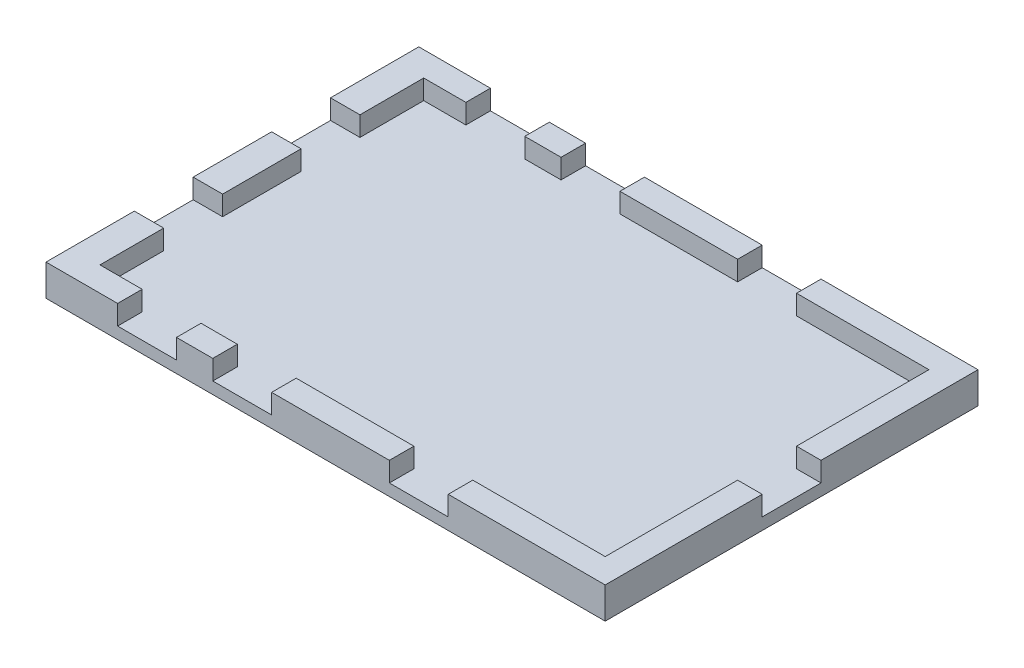
from build123d import *

# Parameters (mm, degrees)
SKETCH1_W           = 57
SKETCH1_H           = 38
BOSS_EXTRUDE1_DEPTH = 1.2
SKETCH3_W           = 3.7
SKETCH3_H           = 2.5
SKETCH3_W_2         = 3
SKETCH3_H_2         = 8
SKETCH3_W_3         = 12
BOSS_EXTRUDE2_DEPTH = 2


with BuildPart() as part:
    # Sketch1 → Boss-Extrude1 (new body)
    with BuildSketch(Plane(origin=(0, 0, 0), x_dir=(1, 0, 0), z_dir=(0, 1, 0))):
        with Locations((-1.5, 0)):
            Rectangle(SKETCH1_W, SKETCH1_H)
    extrude(amount=BOSS_EXTRUDE1_DEPTH)

    # Sketch3 → Boss-Extrude2 (add)
    with BuildSketch(Plane(origin=(0, 1.2, 0), x_dir=(1, 0, 0), z_dir=(0, 1, 0))):
        Polygon((-22.7, -16.5), (-27, -16.5), (-27, -10), (-30, -10), (-30, -19), (-22.7, -19), align=None)
        with Locations((-14.85, -17.75)):
            Rectangle(SKETCH3_W, SKETCH3_H)
        with Locations((-28.5, 0)):
            Rectangle(SKETCH3_W_2, SKETCH3_H_2)
        with Locations((-1, -17.75)):
            Rectangle(SKETCH3_W_3, SKETCH3_H)
        Polygon((11, -16.5), (11, -19), (27, -19), (27, -3), (24.5, -3), (24.5, -16.5), align=None)
        Polygon((24.5, 16.5), (24.5, 3), (27, 3), (27, 19), (11, 19), (11, 16.5), align=None)
        Polygon((-30, 10), (-27, 10), (-27, 16.5), (-22.7, 16.5), (-22.7, 19), (-30, 19), align=None)
        with Locations((-1, 17.75)):
            Rectangle(SKETCH3_W_3, SKETCH3_H)
        with Locations((-14.85, 17.75)):
            Rectangle(SKETCH3_W, SKETCH3_H)
    extrude(amount=BOSS_EXTRUDE2_DEPTH)


solid = part.part
